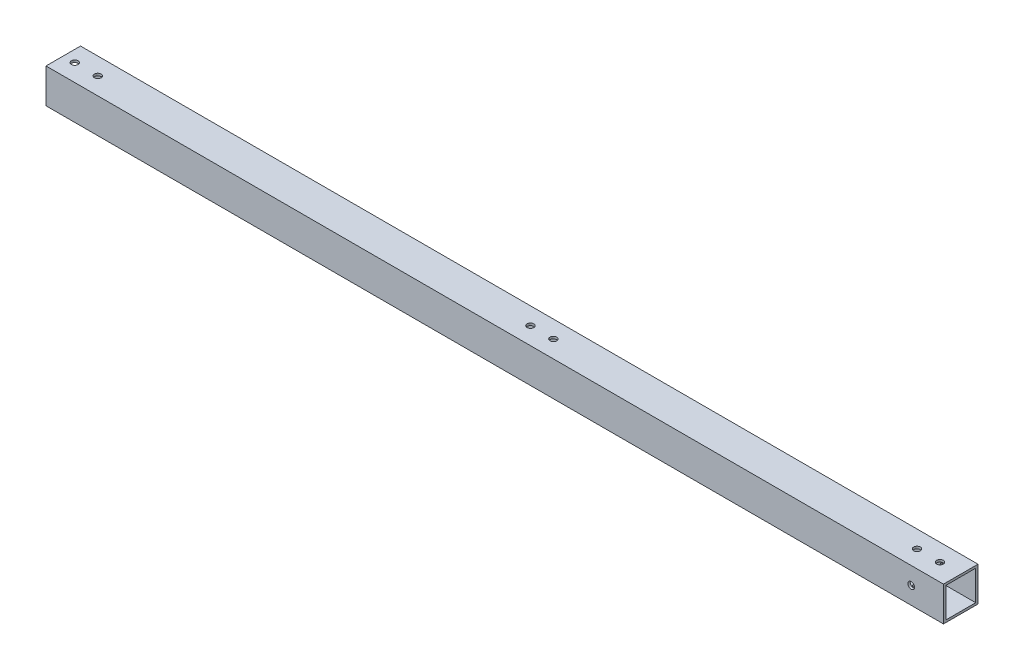
from build123d import *

# Parameters (mm, degrees)
SKETCH_1_W          = 15
SKETCH_1_H          = 15
SKETCH_1_W_2        = 13
SKETCH_1_H_2        = 13
EXTRUDE_1_DEPTH     = 390
SKETCH_2_R          = 1.45
CUT_EXTRUDE_1_DEPTH = 391.36041039
SKETCH_3_R          = 1.45
CUT_EXTRUDE_2_DEPTH = 391.36041039


with BuildPart() as part:
    # 草图1 → 凸台-拉伸1 (new body)
    with BuildSketch(Plane(origin=(0, 0, 0), x_dir=(0, 0, -1), z_dir=(1, 0, 0))):
        Rectangle(SKETCH_1_W, SKETCH_1_H)
        Rectangle(SKETCH_1_W_2, SKETCH_1_H_2, mode=Mode.SUBTRACT)
    extrude(amount=EXTRUDE_1_DEPTH)

    # 草图2 → 切除-拉伸1 (cut, through all)
    with BuildSketch(Plane(origin=(0, 7.5, 0), x_dir=(1, 0, 0), z_dir=(0, 1, 0))):
        with Locations(Location((203, 0, 0), (0, 0, 270))):
            Circle(SKETCH_2_R)
        with Locations(Location((213, 0, 0), (0, 0, 270))):
            Circle(SKETCH_2_R)
        with Locations(Location((15, 0, 0), (0, 0, 270))):
            Circle(SKETCH_2_R)
        with Locations(Location((5, 0, 0), (0, 0, 270))):
            Circle(SKETCH_2_R)
        with Locations(Location((381, 0, 0), (0, 0, 270))):
            Circle(SKETCH_2_R)
        with Locations(Location((371, 0, 0), (0, 0, 270))):
            Circle(SKETCH_2_R)
    extrude(amount=-CUT_EXTRUDE_1_DEPTH, mode=Mode.SUBTRACT)

    # 草图3 → 切除-拉伸2 (cut, through all)
    with BuildSketch(Plane(origin=(0, 0, -7.5), x_dir=(-1, 0, 0), z_dir=(0, 0, -1))):
        with Locations((-376, 0)):
            Circle(SKETCH_3_R)
    extrude(amount=-CUT_EXTRUDE_2_DEPTH, mode=Mode.SUBTRACT)


solid = part.part
